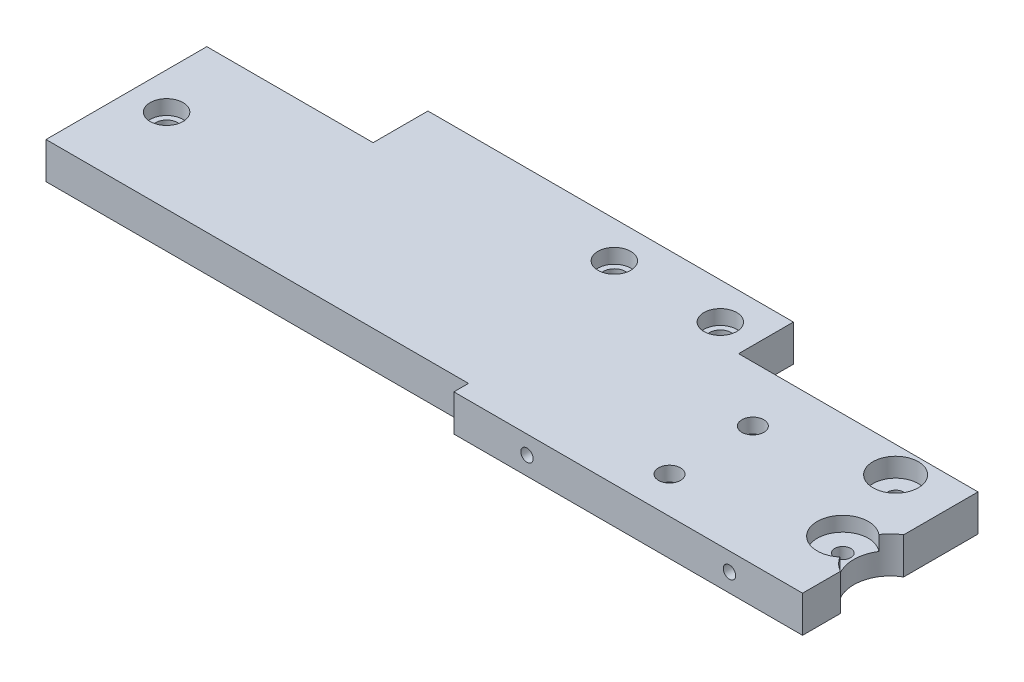
from build123d import *

# Parameters (mm, degrees)
EXTRUDE_1_DEPTH      = 5
SKETCH_1_20_R        = 1.5
CUT_EXTRUDE_2_DEPTH  = 79.662649968
CUT_EXTRUDE_START    = 5
SKETCH_1_22_R        = 2.25
CUT_EXTRUDE_3_DEPTH  = 2
SKETCH_1_23_R        = 3.1
CUT_EXTRUDE_4_DEPTH  = 2.6
SKETCH_1_24_R        = 1.1
CUT_EXTRUDE_6_DEPTH  = 84.662649968
SKETCH_4_R           = 1.5
CUT_EXTRUDE_7_DEPTH  = 79.662649968
SKETCH_4_3_R         = 2.25
CUT_EXTRUDE_8_DEPTH  = 3
SKETCH_5_W           = 47.701964887
SKETCH_5_H           = 5
EXTRUDE_2_DEPTH      = 2
SKETCH_6_R           = 0.85
CUT_EXTRUDE_9_DEPTH  = 4
SKETCH_1_25_R        = 5
CUT_EXTRUDE_12_DEPTH = 80.434328221
SKETCH_1_26_R        = 3.5
CUT_EXTRUDE_13_DEPTH = 2


with BuildPart() as part:
    # 草图1 → 凸台-拉伸1 (new body)
    with BuildSketch(Plane(origin=(0, 0, 0), x_dir=(1, 0, 0), z_dir=(0, 1, 0))):
        Polygon((-72.75, -7.5), (-72.75, -29.5), (32.75, -29.5), (32.75, -7.5), (0, -7.5), (0, 0), (-50, 0), (-50, -7.5), align=None)
    extrude(amount=EXTRUDE_1_DEPTH)

    # 草图1<20> → 切除-拉伸2 (cut, through all)
    with BuildSketch(Plane(origin=(0, 0, 0), x_dir=(1, 0, 0), z_dir=(0, 1, 0))):
        with Locations(Location((-19.5, -5, 0), (0, 0, 270))):
            Circle(SKETCH_1_20_R)
        with Locations(Location((-5, -5, 0), (0, 0, 270))):
            Circle(SKETCH_1_20_R)
        with Locations(Location((-67.75, -18, 0), (0, 0, 270))):
            Circle(SKETCH_1_20_R)
    extrude(amount=CUT_EXTRUDE_2_DEPTH, mode=Mode.SUBTRACT)

    # 草图1<22> → 切除-拉伸3 (cut)
    with BuildSketch(Plane(origin=(0, 0, 0), x_dir=(1, 0, 0), z_dir=(0, 1, 0)).offset(CUT_EXTRUDE_START)):
        with Locations(Location((-19.5, -5, 0), (0, 0, 270))):
            Circle(SKETCH_1_22_R)
        with Locations(Location((-5, -5, 0), (0, 0, 270))):
            Circle(SKETCH_1_22_R)
        with Locations(Location((-67.75, -18, 0), (0, 0, 270))):
            Circle(SKETCH_1_22_R)
    extrude(amount=-CUT_EXTRUDE_3_DEPTH, mode=Mode.SUBTRACT)

    # 草图1<23> → 切除-拉伸4 (cut)
    with BuildSketch(Plane(origin=(0, 0, 0), x_dir=(1, 0, 0), z_dir=(0, 1, 0)).offset(CUT_EXTRUDE_START)):
        with Locations(Location((25.083939444, -11.1, 0), (0, 0, 270))):
            Circle(SKETCH_1_23_R)
    extrude(amount=-CUT_EXTRUDE_4_DEPTH, mode=Mode.SUBTRACT)

    # 草图1<24> → 切除-拉伸6 (cut, through all)
    with BuildSketch(Plane(origin=(0, 0, 0), x_dir=(1, 0, 0), z_dir=(0, 1, 0)).offset(CUT_EXTRUDE_START)):
        with Locations(Location((28.75, -22, 0), (0, 0, 270))):
            Circle(SKETCH_1_24_R)
        with Locations(Location((25.083939444, -11.1, 0), (0, 0, 270))):
            Circle(SKETCH_1_24_R)
    extrude(amount=-CUT_EXTRUDE_6_DEPTH, mode=Mode.SUBTRACT)

    # 草图4 → 切除-拉伸7 (cut, through all)
    with BuildSketch(Plane.XZ):
        with Locations(Location((9.548035113, 15.1, 0), (0, 0, 270))):
            Circle(SKETCH_4_R)
        with Locations(Location((9.548035113, 26.5, 0), (0, 0, 270))):
            Circle(SKETCH_4_R)
    extrude(amount=-CUT_EXTRUDE_7_DEPTH, mode=Mode.SUBTRACT)

    # 草图4<3> → 切除-拉伸8 (cut)
    with BuildSketch(Plane.XZ):
        with Locations(Location((9.548035113, 15.1, 0), (0, 0, 270))):
            Circle(SKETCH_4_3_R)
        with Locations(Location((9.548035113, 26.5, 0), (0, 0, 270))):
            Circle(SKETCH_4_3_R)
    extrude(amount=-CUT_EXTRUDE_8_DEPTH, mode=Mode.SUBTRACT)

    # 草图5 → 凸台-拉伸2 (add)
    with BuildSketch(Plane.XY.offset(29.5)):
        with Locations((8.899017556, 2.5)):
            Rectangle(SKETCH_5_W, SKETCH_5_H)
    extrude(amount=EXTRUDE_2_DEPTH)

    # 草图6 → 切除-拉伸9 (cut)
    with BuildSketch(Plane.XY.offset(31.5)):
        with Locations((22.75, 2.5)):
            Circle(SKETCH_6_R)
        with Locations((-4.951964887, 2.5)):
            Circle(SKETCH_6_R)
    extrude(amount=-CUT_EXTRUDE_9_DEPTH, mode=Mode.SUBTRACT)

    # 草图1<25> → 切除-拉伸12 (cut, through all)
    with BuildSketch(Plane(origin=(0, 0, 0), x_dir=(1, 0, 0), z_dir=(0, 1, 0))):
        with Locations((35.25, -22)):
            Circle(SKETCH_1_25_R)
    extrude(amount=CUT_EXTRUDE_12_DEPTH, mode=Mode.SUBTRACT)

    # 草图1<26> → 切除-拉伸13 (cut)
    with BuildSketch(Plane(origin=(0, 0, 0), x_dir=(1, 0, 0), z_dir=(0, 1, 0)).offset(CUT_EXTRUDE_START)):
        with Locations((28.75, -22)):
            Circle(SKETCH_1_26_R)
    extrude(amount=-CUT_EXTRUDE_13_DEPTH, mode=Mode.SUBTRACT)


solid = part.part
